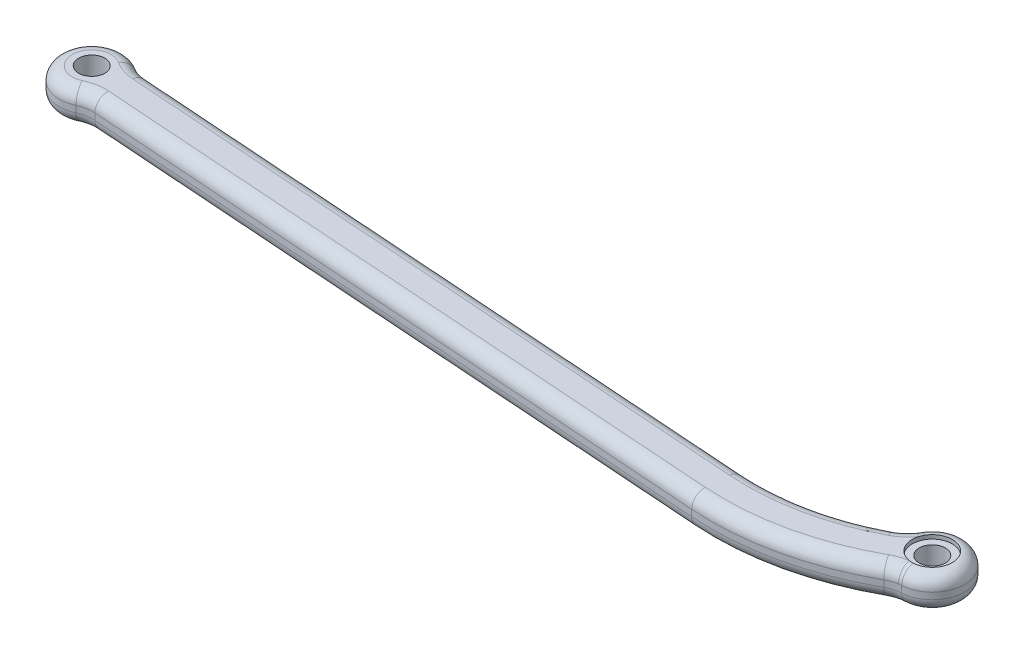
from build123d import *

# Parameters (mm, degrees)
CROQUIS1_R                                           = 4.05
SALIENTE_EXTRUIR1_DEPTH                              = 5
CROQUIS2_R                                           = 10
SALIENTE_EXTRUIR2_DEPTH                              = 10
REDONDEO8_R                                          = 10
REFRENTADO_PARA_TORNILLO_CON_CABEZA_PLAN_D           = 8.1
REFRENTADO_PARA_TORNILLO_CON_CABEZA_PLAN_CBORE_D     = 12.4
REFRENTADO_PARA_TORNILLO_CON_CABEZA_PLAN_CBORE_DEPTH = 1.2
REDONDEO9_R                                          = 4
REFRENTADO_PARA_TORNILLO_CON_CABEZA_2_D              = 8.1
REFRENTADO_PARA_TORNILLO_CON_CABEZA_2_CBORE_D        = 12.4
REFRENTADO_PARA_TORNILLO_CON_CABEZA_2_CBORE_DEPTH    = 1.2


with BuildPart() as part:
    # Croquis1 → Saliente-Extruir1 (new, symmetric)
    with BuildSketch(Plane(origin=(0, 0, 0), x_dir=(-1, 0, 0), z_dir=(0, 1, 0))):
        with BuildLine():
            Line((52.388821078, 22.035902101), (260.523173553, 7.481730377))
            ThreePointArc((260.523173553, 7.481730377), (267.481730377, -0.523173553), (259.476826447, -7.481730377))
            Line((259.476826447, -7.481730377), (51.342473972, 7.072441348))
            ThreePointArc((51.342473972, 7.072441348), (26.697288319, 4.552818898), (4.339230902, -6.117276778))
            ThreePointArc((4.339230902, -6.117276778), (-6.117276778, -4.339230902), (-4.339230902, 6.117276778))
            ThreePointArc((-4.339230902, 6.117276778), (22.644631497, 18.994978455), (52.388821078, 22.035902101))
        make_face()
        with Locations(Location((0, 0, 0), (0, 0, 90))):
            Circle(CROQUIS1_R, mode=Mode.SUBTRACT)
        with Locations(Location((260, 0, 0), (0, 0, 90))):
            Circle(CROQUIS1_R, mode=Mode.SUBTRACT)
    extrude(amount=SALIENTE_EXTRUIR1_DEPTH, both=True)

    # Croquis2 → Saliente-Extruir2 (add)
    with BuildSketch(Plane(origin=(0, 5, 0), x_dir=(-1, 0, 0), z_dir=(0, 1, 0))):
        Circle(CROQUIS2_R)
        with Locations((260, 0)):
            Circle(CROQUIS2_R)
    extrude(amount=-SALIENTE_EXTRUIR2_DEPTH)

    # Redondeo8
    redondeo8_edges = [part.edges().sort_by_distance(p)[0] for p in [
        (-1.45671448, 0, 9.893330224),
        (-253.924907568, 0, 7.943126082),
        (-9.62840856, 0, -2.700694098),
        (-252.878560462, 0, -7.020334672),
    ]]
    fillet(redondeo8_edges, radius=REDONDEO8_R)

    # Refrentado para tornillo con cabeza plan (through all)
    with Locations(Plane(origin=(0, 5, 0), x_dir=(-1, 0, 0), z_dir=(0, 1, 0))):
        with Locations((0, 0)):
            CounterBoreHole(REFRENTADO_PARA_TORNILLO_CON_CABEZA_PLAN_D / 2, REFRENTADO_PARA_TORNILLO_CON_CABEZA_PLAN_CBORE_D / 2, REFRENTADO_PARA_TORNILLO_CON_CABEZA_PLAN_CBORE_DEPTH)

    # Redondeo9
    redondeo9_edges = [part.edges().sort_by_distance(p)[0] for p in [
        (-150.580214018, 5, 0.133062562),
        (-27.298211365, 5, 20.16419235),
        (-31.522388758, 5, 5.730111954),
        (-31.522388758, -5, 5.730111954),
        (8.493504141, 5, -5.278293987),
        (8.493504141, -5, -5.278293987),
        (-269.975640503, -5, -0.697564737),
        (-269.975640503, 5, -0.697564737),
        (-151.626561124, 5, 15.096523316),
        (-151.626561124, -5, 15.096523316),
        (-27.298211365, -5, 20.16419235),
        (-10.473813488, -5, -2.625536281),
        (-10.473813488, 5, -2.625536281),
        (-252.289713604, 5, -7.297475528),
        (-252.289713604, -5, -7.297475528),
        (-253.38036188, -5, 8.299521464),
        (-253.38036188, 5, 8.299521464),
        (-1.68943962, 5, 10.362079146),
        (-1.68943962, -5, 10.362079146),
        (-150.580214018, -5, 0.133062562),
    ]]
    fillet(redondeo9_edges, radius=REDONDEO9_R)

    # Refrentado para tornillo con cabeza  2 (through all)
    with Locations(Plane.XZ.offset(5)):
        with Locations((-260, 0)):
            CounterBoreHole(REFRENTADO_PARA_TORNILLO_CON_CABEZA_2_D / 2, REFRENTADO_PARA_TORNILLO_CON_CABEZA_2_CBORE_D / 2, REFRENTADO_PARA_TORNILLO_CON_CABEZA_2_CBORE_DEPTH)


solid = part.part
